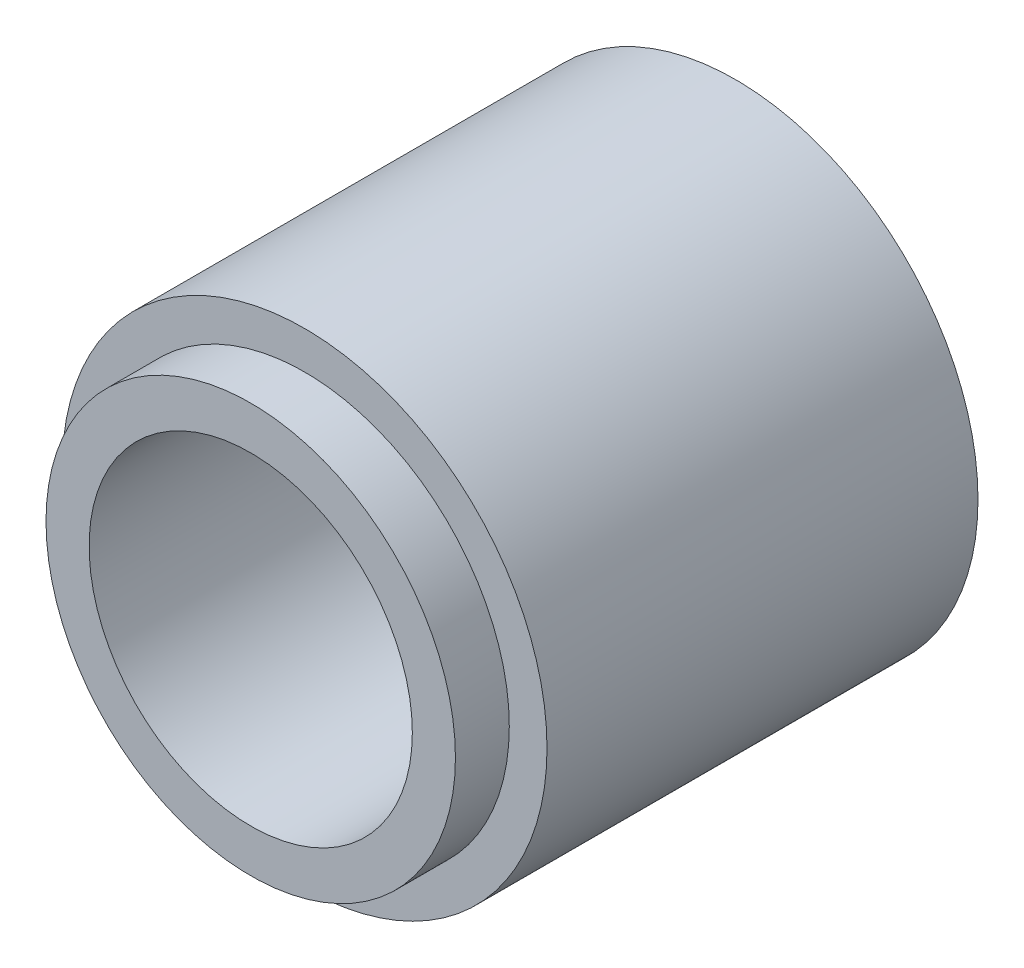
from build123d import *

# Parameters (mm, degrees)
SKETCH_1_R          = 2.25
SKETCH_1_R_2        = 1.5
EXTRUDE_1_DEPTH     = 4.5
CUT_EXTRUDE_START   = -0.5
SKETCH_2_R          = 2.25
SKETCH_2_R_2        = 1.9
CUT_EXTRUDE_1_DEPTH = 0.5


with BuildPart() as part:
    # 草图1 → 凸台-拉伸1 (new body)
    with BuildSketch(Plane.XY):
        Circle(SKETCH_1_R)
        Circle(SKETCH_1_R_2, mode=Mode.SUBTRACT)
    extrude(amount=EXTRUDE_1_DEPTH)

    # 草图2 → 切除-拉伸1 (cut)
    with BuildSketch(Plane.XY.offset(4.5).offset(CUT_EXTRUDE_START)):
        Circle(SKETCH_2_R)
        Circle(SKETCH_2_R_2, mode=Mode.SUBTRACT)
    extrude(amount=CUT_EXTRUDE_1_DEPTH, mode=Mode.SUBTRACT)


solid = part.part
